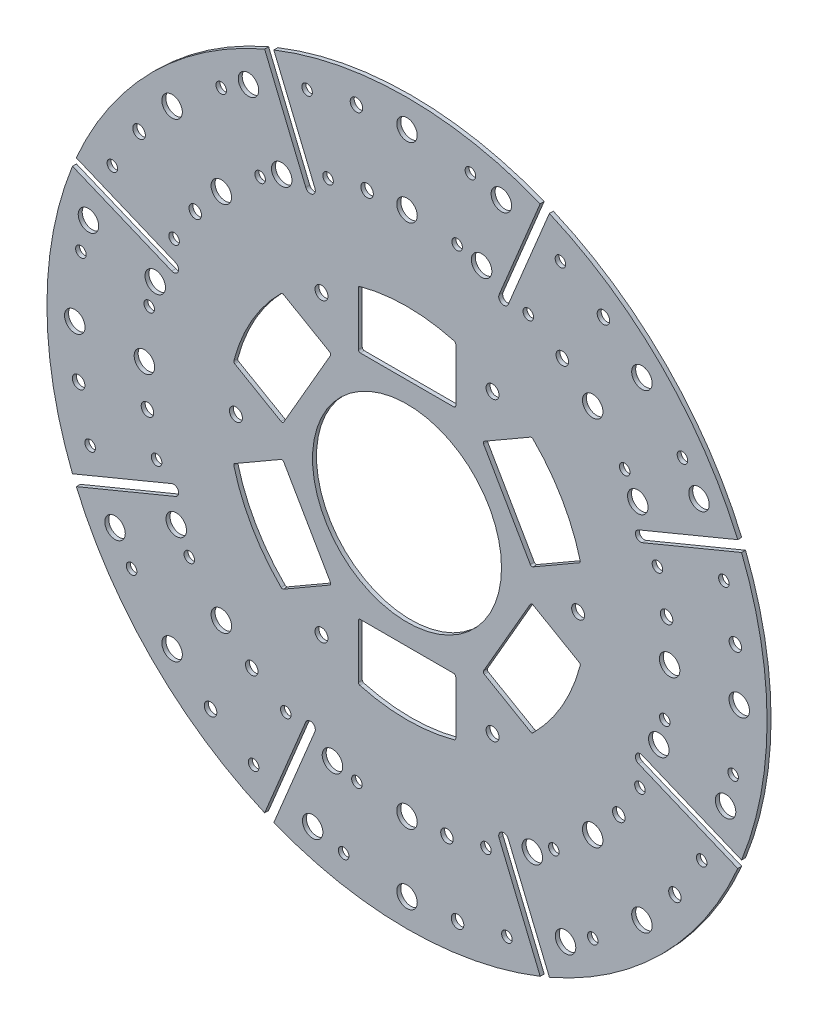
from build123d import *

# Parameters (mm, degrees)
ESBO_O1_R                = 181
ESBO_O1_R_2              = 47.5
RESSALTO_EXTRUS_O1_DEPTH = 2
CORTE_EXTRUS_O1_DEPTH    = 2
ESBO_O4_R                = 5.15
ESBO_O4_R_2              = 3.15
ESBO_O4_R_3              = 2.65
CORTE_EXTRUS_O2_DEPTH    = 2
CORTE_EXTRUS_O3_DEPTH    = 2
ESBO_O6_R                = 3.25
CORTE_EXTRUS_O4_DEPTH    = 2
FILETE1_R                = 1


with BuildPart() as part:
    # Esboço1 → Ressalto-extrusão1 (new body)
    with BuildSketch(Plane.XY):
        Circle(ESBO_O1_R)
        Circle(ESBO_O1_R_2, mode=Mode.SUBTRACT)
    extrude(amount=RESSALTO_EXTRUS_O1_DEPTH)

    # Esboço2 → Corte-extrusão1 (cut)
    with BuildSketch(Plane.XY.offset(2)):
        with BuildLine():
            Line((-66.956002427, -168.178903965), (-71.575400089, -166.265486804))
            Line((-71.575400089, -166.265486804), (-50.901077406, -116.353256589))
            ThreePointArc((-50.901077406, -116.353256589), (-47.634669994, -115.000266339), (-46.281679744, -118.266673751))
            Line((-46.281679744, -118.266673751), (-66.956002427, -168.178903965))
        make_face()
        with BuildLine():
            Line((-166.265486804, -71.575400089), (-168.178903965, -66.956002427))
            Line((-168.178903965, -66.956002427), (-118.266673751, -46.281679744))
            ThreePointArc((-118.266673751, -46.281679744), (-115.000266339, -47.634669994), (-116.353256589, -50.901077406))
            Line((-116.353256589, -50.901077406), (-166.265486804, -71.575400089))
        make_face()
        with BuildLine():
            Line((-168.178903965, 66.956002427), (-166.265486804, 71.575400089))
            Line((-166.265486804, 71.575400089), (-116.353256589, 50.901077406))
            ThreePointArc((-116.353256589, 50.901077406), (-115.000266339, 47.634669994), (-118.266673751, 46.281679744))
            Line((-118.266673751, 46.281679744), (-168.178903965, 66.956002427))
        make_face()
        with BuildLine():
            Line((-71.575400089, 166.265486804), (-66.956002427, 168.178903965))
            Line((-66.956002427, 168.178903965), (-46.281679744, 118.266673751))
            ThreePointArc((-46.281679744, 118.266673751), (-47.634669994, 115.000266339), (-50.901077406, 116.353256589))
            Line((-50.901077406, 116.353256589), (-71.575400089, 166.265486804))
        make_face()
        with BuildLine():
            Line((66.956002427, 168.178903965), (71.575400089, 166.265486804))
            Line((71.575400089, 166.265486804), (50.901077406, 116.353256589))
            ThreePointArc((50.901077406, 116.353256589), (47.634669994, 115.000266339), (46.281679744, 118.266673751))
            Line((46.281679744, 118.266673751), (66.956002427, 168.178903965))
        make_face()
        with BuildLine():
            Line((166.265486804, 71.575400089), (168.178903965, 66.956002427))
            Line((168.178903965, 66.956002427), (118.266673751, 46.281679744))
            ThreePointArc((118.266673751, 46.281679744), (115.000266339, 47.634669994), (116.353256589, 50.901077406))
            Line((116.353256589, 50.901077406), (166.265486804, 71.575400089))
        make_face()
        with BuildLine():
            Line((168.178903965, -66.956002427), (166.265486804, -71.575400089))
            Line((166.265486804, -71.575400089), (116.353256589, -50.901077406))
            ThreePointArc((116.353256589, -50.901077406), (115.000266339, -47.634669994), (118.266673751, -46.281679744))
            Line((118.266673751, -46.281679744), (168.178903965, -66.956002427))
        make_face()
        with BuildLine():
            Line((71.575400089, -166.265486804), (66.956002427, -168.178903965))
            Line((66.956002427, -168.178903965), (46.281679744, -118.266673751))
            ThreePointArc((46.281679744, -118.266673751), (47.634669994, -115.000266339), (50.901077406, -116.353256589))
            Line((50.901077406, -116.353256589), (71.575400089, -166.265486804))
        make_face()
    extrude(amount=-CORTE_EXTRUS_O1_DEPTH, mode=Mode.SUBTRACT)

    # Esboço4 → Corte-extrusão2 (cut)
    with BuildSketch(Plane.XY.offset(2)):
        with Locations((0, 167)):
            Circle(ESBO_O4_R)
        with Locations((0, 132)):
            Circle(ESBO_O4_R)
        with Locations((47.430562566, 160.122895723)):
            Circle(ESBO_O4_R)
        with Locations((37.490025501, 126.564205003)):
            Circle(ESBO_O4_R)
        with Locations((-25.404605494, 165.056372248)):
            Circle(ESBO_O4_R_2)
        with Locations((-20.080286977, 130.463719382)):
            Circle(ESBO_O4_R_2)
        with Locations((-50.217868517, 159.270730775)):
            Circle(ESBO_O4_R_3)
        with Locations((-39.693165535, 125.890637499)):
            Circle(ESBO_O4_R_3)
        with Locations((25.18678739, 129.574788215)):
            Circle(ESBO_O4_R_3)
        with Locations((31.865102228, 163.931739636)):
            Circle(ESBO_O4_R_3)
        with Locations((118.086832458, 118.086832458)):
            Circle(ESBO_O4_R)
        with Locations((93.338095117, 93.338095117)):
            Circle(ESBO_O4_R)
        with Locations((146.762457815, 79.685512963)):
            Circle(ESBO_O4_R)
        with Locations((116.003858871, 62.984956354)):
            Circle(ESBO_O4_R)
        with Locations((98.748711277, 134.676248913)):
            Circle(ESBO_O4_R_2)
        with Locations((78.052873584, 106.450687763)):
            Circle(ESBO_O4_R_2)
        with Locations((77.11201841, 148.130809141)):
            Circle(ESBO_O4_R_3)
        with Locations((60.950816947, 117.08542998)):
            Circle(ESBO_O4_R_3)
        with Locations((109.432959577, 73.813463258)):
            Circle(ESBO_O4_R_3)
        with Locations((138.449274617, 93.38521488)):
            Circle(ESBO_O4_R_3)
        with Locations((167, 0)):
            Circle(ESBO_O4_R)
        with Locations((132, 0)):
            Circle(ESBO_O4_R)
        with Locations((160.122895723, -47.430562566)):
            Circle(ESBO_O4_R)
        with Locations((126.564205003, -37.490025501)):
            Circle(ESBO_O4_R)
        with Locations((165.056372248, 25.404605494)):
            Circle(ESBO_O4_R_2)
        with Locations((130.463719382, 20.080286977)):
            Circle(ESBO_O4_R_2)
        with Locations((159.270730775, 50.217868517)):
            Circle(ESBO_O4_R_3)
        with Locations((125.890637499, 39.693165535)):
            Circle(ESBO_O4_R_3)
        with Locations((129.574788215, -25.18678739)):
            Circle(ESBO_O4_R_3)
        with Locations((163.931739636, -31.865102228)):
            Circle(ESBO_O4_R_3)
        with Locations((118.086832458, -118.086832458)):
            Circle(ESBO_O4_R)
        with Locations((93.338095117, -93.338095117)):
            Circle(ESBO_O4_R)
        with Locations((79.685512963, -146.762457815)):
            Circle(ESBO_O4_R)
        with Locations((62.984956354, -116.003858871)):
            Circle(ESBO_O4_R)
        with Locations((134.676248913, -98.748711277)):
            Circle(ESBO_O4_R_2)
        with Locations((106.450687763, -78.052873584)):
            Circle(ESBO_O4_R_2)
        with Locations((148.130809141, -77.11201841)):
            Circle(ESBO_O4_R_3)
        with Locations((117.08542998, -60.950816947)):
            Circle(ESBO_O4_R_3)
        with Locations((73.813463258, -109.432959577)):
            Circle(ESBO_O4_R_3)
        with Locations((93.38521488, -138.449274617)):
            Circle(ESBO_O4_R_3)
        with Locations((0, -167)):
            Circle(ESBO_O4_R)
        with Locations((0, -132)):
            Circle(ESBO_O4_R)
        with Locations((-47.430562566, -160.122895723)):
            Circle(ESBO_O4_R)
        with Locations((-37.490025501, -126.564205003)):
            Circle(ESBO_O4_R)
        with Locations((25.404605494, -165.056372248)):
            Circle(ESBO_O4_R_2)
        with Locations((20.080286977, -130.463719382)):
            Circle(ESBO_O4_R_2)
        with Locations((50.217868517, -159.270730775)):
            Circle(ESBO_O4_R_3)
        with Locations((39.693165535, -125.890637499)):
            Circle(ESBO_O4_R_3)
        with Locations((-25.18678739, -129.574788215)):
            Circle(ESBO_O4_R_3)
        with Locations((-31.865102228, -163.931739636)):
            Circle(ESBO_O4_R_3)
        with Locations((-118.086832458, -118.086832458)):
            Circle(ESBO_O4_R)
        with Locations((-93.338095117, -93.338095117)):
            Circle(ESBO_O4_R)
        with Locations((-146.762457815, -79.685512963)):
            Circle(ESBO_O4_R)
        with Locations((-116.003858871, -62.984956354)):
            Circle(ESBO_O4_R)
        with Locations((-98.748711277, -134.676248913)):
            Circle(ESBO_O4_R_2)
        with Locations((-78.052873584, -106.450687763)):
            Circle(ESBO_O4_R_2)
        with Locations((-77.11201841, -148.130809141)):
            Circle(ESBO_O4_R_3)
        with Locations((-60.950816947, -117.08542998)):
            Circle(ESBO_O4_R_3)
        with Locations((-109.432959577, -73.813463258)):
            Circle(ESBO_O4_R_3)
        with Locations((-138.449274617, -93.38521488)):
            Circle(ESBO_O4_R_3)
        with Locations((-167, 0)):
            Circle(ESBO_O4_R)
        with Locations((-132, 0)):
            Circle(ESBO_O4_R)
        with Locations((-160.122895723, 47.430562566)):
            Circle(ESBO_O4_R)
        with Locations((-126.564205003, 37.490025501)):
            Circle(ESBO_O4_R)
        with Locations((-165.056372248, -25.404605494)):
            Circle(ESBO_O4_R_2)
        with Locations((-130.463719382, -20.080286977)):
            Circle(ESBO_O4_R_2)
        with Locations((-159.270730775, -50.217868517)):
            Circle(ESBO_O4_R_3)
        with Locations((-125.890637499, -39.693165535)):
            Circle(ESBO_O4_R_3)
        with Locations((-129.574788215, 25.18678739)):
            Circle(ESBO_O4_R_3)
        with Locations((-163.931739636, 31.865102228)):
            Circle(ESBO_O4_R_3)
        with Locations((-118.086832458, 118.086832458)):
            Circle(ESBO_O4_R)
        with Locations((-93.338095117, 93.338095117)):
            Circle(ESBO_O4_R)
        with Locations((-79.685512963, 146.762457815)):
            Circle(ESBO_O4_R)
        with Locations((-62.984956354, 116.003858871)):
            Circle(ESBO_O4_R)
        with Locations((-134.676248913, 98.748711277)):
            Circle(ESBO_O4_R_2)
        with Locations((-106.450687763, 78.052873584)):
            Circle(ESBO_O4_R_2)
        with Locations((-148.130809141, 77.11201841)):
            Circle(ESBO_O4_R_3)
        with Locations((-117.08542998, 60.950816947)):
            Circle(ESBO_O4_R_3)
        with Locations((-73.813463258, 109.432959577)):
            Circle(ESBO_O4_R_3)
        with Locations((-93.38521488, 138.449274617)):
            Circle(ESBO_O4_R_3)
    extrude(amount=-CORTE_EXTRUS_O2_DEPTH, mode=Mode.SUBTRACT)

    # Esboço5 → Corte-extrusão3 (cut)
    with BuildSketch(Plane.XY.offset(2)):
        with BuildLine():
            Line((-24.5, 58), (24.5, 58))
            Line((24.5, 58), (24.5, 86.601096991))
            ThreePointArc((24.5, 86.601096991), (0, 90), (-24.5, 86.601096991))
            Line((-24.5, 86.601096991), (-24.5, 58))
        make_face()
        with BuildLine():
            Line((37.97947342, 50.217622393), (62.47947342, 7.782377607))
            Line((62.47947342, 7.782377607), (87.24874999, 22.082926103))
            ThreePointArc((87.24874999, 22.082926103), (77.942286341, 45), (62.74874999, 64.518170888))
            Line((62.74874999, 64.518170888), (37.97947342, 50.217622393))
        make_face()
        with BuildLine():
            Line((62.479473419, -7.782377607), (37.979473419, -50.217622393))
            Line((37.979473419, -50.217622393), (62.74874999, -64.518170888))
            ThreePointArc((62.74874999, -64.518170888), (77.942286341, -45), (87.24874999, -22.082926103))
            Line((87.24874999, -22.082926103), (62.479473419, -7.782377607))
        make_face()
        with BuildLine():
            Line((24.5, -58), (-24.5, -58))
            Line((-24.5, -58), (-24.5, -86.601096991))
            ThreePointArc((-24.5, -86.601096991), (0, -90), (24.5, -86.601096991))
            Line((24.5, -86.601096991), (24.5, -58))
        make_face()
        with BuildLine():
            Line((-37.97947342, -50.217622393), (-62.47947342, -7.782377607))
            Line((-62.47947342, -7.782377607), (-87.24874999, -22.082926103))
            ThreePointArc((-87.24874999, -22.082926103), (-77.942286341, -45), (-62.74874999, -64.518170888))
            Line((-62.74874999, -64.518170888), (-37.97947342, -50.217622393))
        make_face()
        with BuildLine():
            Line((-62.479473419, 7.782377607), (-37.979473419, 50.217622393))
            Line((-37.979473419, 50.217622393), (-62.74874999, 64.518170888))
            ThreePointArc((-62.74874999, 64.518170888), (-77.942286341, 45), (-87.24874999, 22.082926103))
            Line((-87.24874999, 22.082926103), (-62.479473419, 7.782377607))
        make_face()
    extrude(amount=-CORTE_EXTRUS_O3_DEPTH, mode=Mode.SUBTRACT)

    # Esboço6 → Corte-extrusão4 (cut)
    with BuildSketch(Plane.XY.offset(2)):
        with Locations((43, 74.478184725)):
            Circle(ESBO_O6_R)
        with Locations((86, 0)):
            Circle(ESBO_O6_R)
        with Locations((43, -74.478184725)):
            Circle(ESBO_O6_R)
        with Locations((-43, -74.478184725)):
            Circle(ESBO_O6_R)
        with Locations((-86, 0)):
            Circle(ESBO_O6_R)
        with Locations((-43, 74.478184725)):
            Circle(ESBO_O6_R)
    extrude(amount=-CORTE_EXTRUS_O4_DEPTH, mode=Mode.SUBTRACT)

    # Filete1
    filete1_edges = [part.edges().sort_by_distance(p)[0] for p in [
        (-24.5, 86.601096991, 1),
        (24.5, 86.601096991, 1),
        (24.5, 58, 1),
        (-24.5, 58, 1),
        (62.74874999, 64.518170888, 1),
        (87.24874999, 22.082926103, 1),
        (62.47947342, 7.782377607, 1),
        (37.97947342, 50.217622393, 1),
        (87.24874999, -22.082926103, 1),
        (62.74874999, -64.518170888, 1),
        (37.979473419, -50.217622393, 1),
        (62.479473419, -7.782377607, 1),
        (24.5, -86.601096991, 1),
        (-24.5, -86.601096991, 1),
        (-24.5, -58, 1),
        (24.5, -58, 1),
        (-62.74874999, -64.518170888, 1),
        (-87.24874999, -22.082926103, 1),
        (-62.47947342, -7.782377607, 1),
        (-37.97947342, -50.217622393, 1),
        (-87.24874999, 22.082926103, 1),
        (-62.74874999, 64.518170888, 1),
        (-37.979473419, 50.217622393, 1),
        (-62.479473419, 7.782377607, 1),
    ]]
    fillet(filete1_edges, radius=FILETE1_R)


solid = part.part
